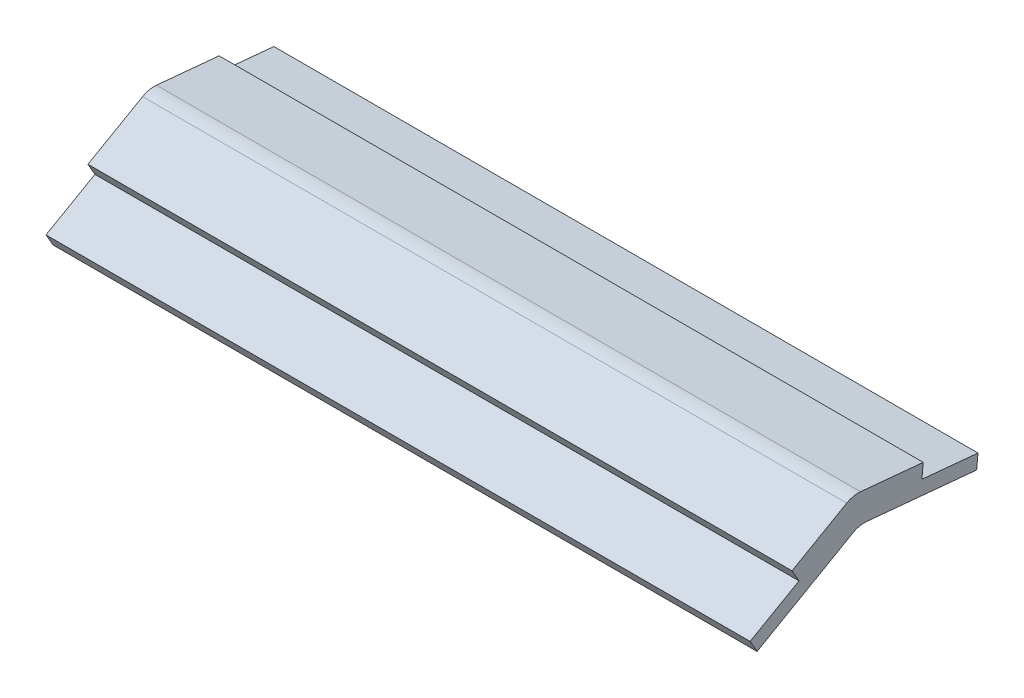
from build123d import *

# Parameters (mm, degrees)
BOSS_EXTRUDE1_DEPTH = 150


with BuildPart() as part:
    # Sketch1 → Boss-Extrude1 (new body)
    with BuildSketch(Plane(origin=(0, 0, 0), x_dir=(0, 0, -1), z_dir=(1, 0, 0))):
        with BuildLine():
            Line((-17.036770748, 11.163475068), (-15.548231796, 8.558815438))
            Line((-15.548231796, 8.558815438), (-25.966870317, 2.60465963))
            Line((-25.966870317, 2.60465963), (-24.478331365, 0))
            Line((-24.478331365, 0), (-4.061294033, 11.668148498))
            ThreePointArc((-4.061294033, 11.668148498), (-2.634767864, 12.21461492), (-1.109822283, 12.304855919))
            Line((-1.109822283, 12.304855919), (22.301972464, 10.091638219))
            Line((22.301972464, 10.091638219), (22.584316562, 13.078322302))
            Line((22.584316562, 13.078322302), (10.637586676, 14.207766865))
            Line((10.637586676, 14.207766865), (10.919947816, 17.194449336))
            Line((10.919947816, 17.194449336), (-2.436908153, 18.457130406))
            ThreePointArc((-2.436908153, 18.457130406), (-3.961853734, 18.366889408), (-5.388379903, 17.820422985))
            Line((-5.388379903, 17.820422985), (-17.036770748, 11.163475068))
        make_face()
    extrude(amount=BOSS_EXTRUDE1_DEPTH)


solid = part.part
